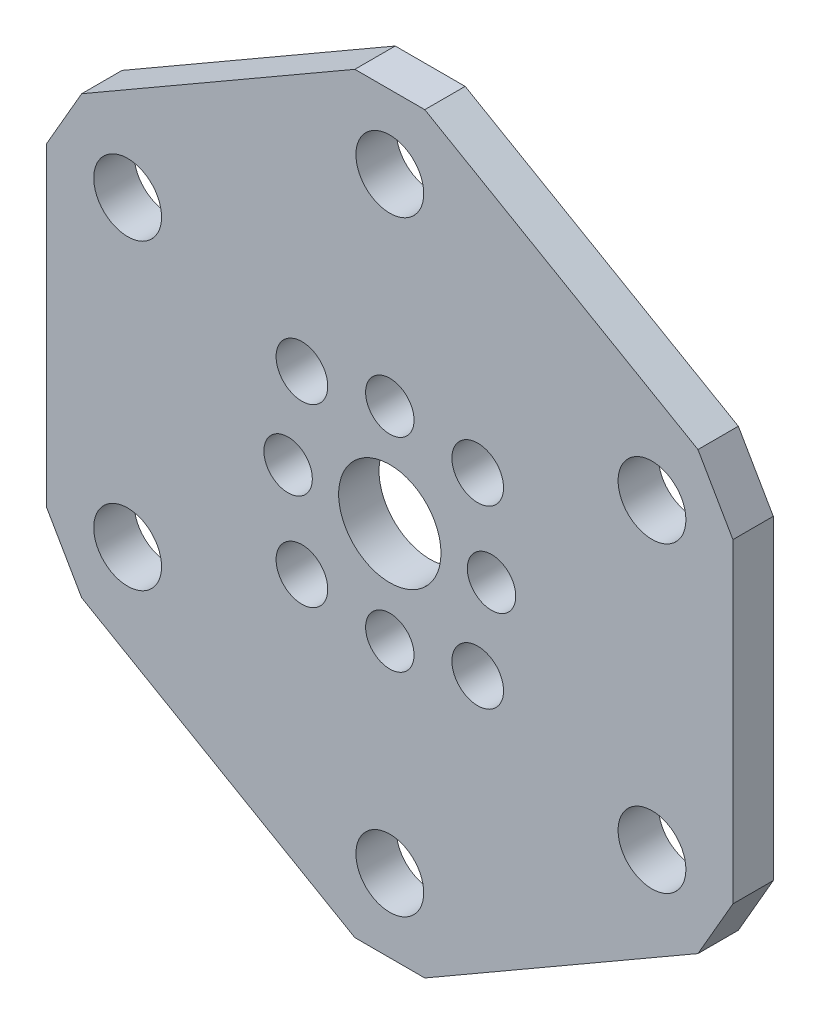
from build123d import *

# Parameters (mm, degrees)
SKETCH1_R           = 2.667
SKETCH1_R_2         = 1.905
SKETCH1_R_3         = 4.025
SKETCH1_R_4         = 2.032
BOSS_EXTRUDE1_DEPTH = 3.175


with BuildPart() as part:
    # Sketch1 → Boss-Extrude1 (new body)
    with BuildSketch(Plane(origin=(0, 0, 0), x_dir=(-1, 0, 0), z_dir=(0, 0, -1))):
        Polygon((2.749630657, 29.57498078), (-2.749630657, 29.57498078), (-24.237869343, 17.16874039), (-26.9875, 12.40624039), (-26.9875, -12.40624039), (-24.237869343, -17.16874039), (-2.749630657, -29.57498078), (2.749630657, -29.57498078), (24.237869343, -17.16874039), (26.9875, -12.40624039), (26.9875, 12.40624039), (24.237869343, 17.16874039), align=None)
        with Locations(Location((20.622229928, 11.90625, 0), (0, 0, 180))):
            Circle(SKETCH1_R, mode=Mode.SUBTRACT)
        with Locations(Location((0, -23.8125, 0), (0, 0, 180))):
            Circle(SKETCH1_R, mode=Mode.SUBTRACT)
        with Locations(Location((-20.622229928, 11.90625, 0), (0, 0, 180))):
            Circle(SKETCH1_R, mode=Mode.SUBTRACT)
        with Locations(Location((0, -8, 0), (0, 0, 180))):
            Circle(SKETCH1_R_2, mode=Mode.SUBTRACT)
        with Locations(Location((0, 8, 0), (0, 0, 180))):
            Circle(SKETCH1_R_2, mode=Mode.SUBTRACT)
        with Locations(Location((0, 23.8125, 0), (0, 0, 180))):
            Circle(SKETCH1_R, mode=Mode.SUBTRACT)
        with Locations(Location((0, 0, 0), (0, 0, 180))):
            Circle(SKETCH1_R_3, mode=Mode.SUBTRACT)
        with Locations(Location((-8, 0, 0), (0, 0, 180))):
            Circle(SKETCH1_R_2, mode=Mode.SUBTRACT)
        with Locations(Location((8, 0, 0), (0, 0, 180))):
            Circle(SKETCH1_R_2, mode=Mode.SUBTRACT)
        with Locations(Location((-20.622229928, -11.90625, 0), (0, 0, 180))):
            Circle(SKETCH1_R, mode=Mode.SUBTRACT)
        with Locations(Location((20.622229928, -11.90625, 0), (0, 0, 180))):
            Circle(SKETCH1_R, mode=Mode.SUBTRACT)
        with Locations(Location((-6.914797213, 6.914797213, 0), (0, 0, 180))):
            Circle(SKETCH1_R_4, mode=Mode.SUBTRACT)
        with Locations(Location((-6.914797213, -6.914797213, 0), (0, 0, 180))):
            Circle(SKETCH1_R_4, mode=Mode.SUBTRACT)
        with Locations(Location((6.914797213, -6.914797213, 0), (0, 0, 180))):
            Circle(SKETCH1_R_4, mode=Mode.SUBTRACT)
        with Locations(Location((6.914797213, 6.914797213, 0), (0, 0, 180))):
            Circle(SKETCH1_R_4, mode=Mode.SUBTRACT)
    extrude(amount=-BOSS_EXTRUDE1_DEPTH)


solid = part.part
